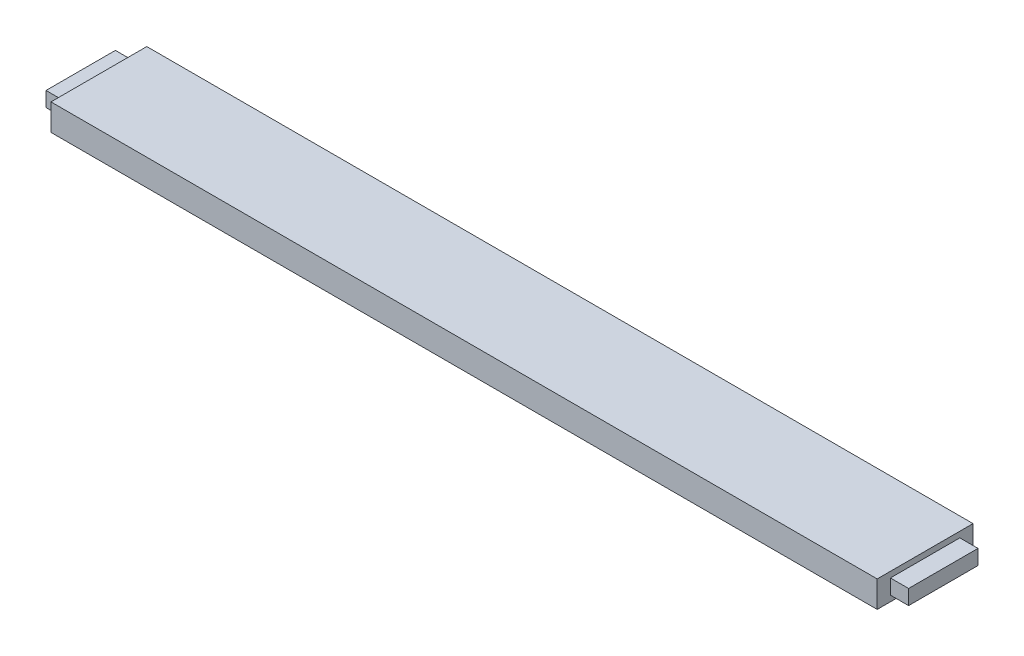
from build123d import *

# Parameters (mm, degrees)
SKETCH_1_W      = 250
SKETCH_1_H      = 28.996988848
EXTRUDE_1_DEPTH = 8
SKETCH_2_W      = 21.001828318
SKETCH_2_H      = 4.50112507
EXTRUDE_2_DEPTH = 5.5
SKETCH_3_W      = 20.998493162
SKETCH_3_H      = 4.496055774
EXTRUDE_3_DEPTH = 5.5


with BuildPart() as part:
    # Эскиз1 → Бобышка-Вытянуть1 (new body)
    with BuildSketch(Plane(origin=(0, 0, 0), x_dir=(1, 0, 0), z_dir=(0, 1, 0))):
        Rectangle(SKETCH_1_W, SKETCH_1_H)
    extrude(amount=EXTRUDE_1_DEPTH)

    # Эскиз2 → Бобышка-Вытянуть2 (add)
    with BuildSketch(Plane(origin=(125, 0, 0), x_dir=(0, 0, -1), z_dir=(1, 0, 0))):
        with Locations((0, 4)):
            Rectangle(SKETCH_2_W, SKETCH_2_H)
    extrude(amount=EXTRUDE_2_DEPTH)

    # Эскиз3 → Бобышка-Вытянуть3 (add)
    with BuildSketch(Plane.ZY.offset(125)):
        with Locations((0, 4)):
            Rectangle(SKETCH_3_W, SKETCH_3_H)
    extrude(amount=EXTRUDE_3_DEPTH)


solid = part.part
